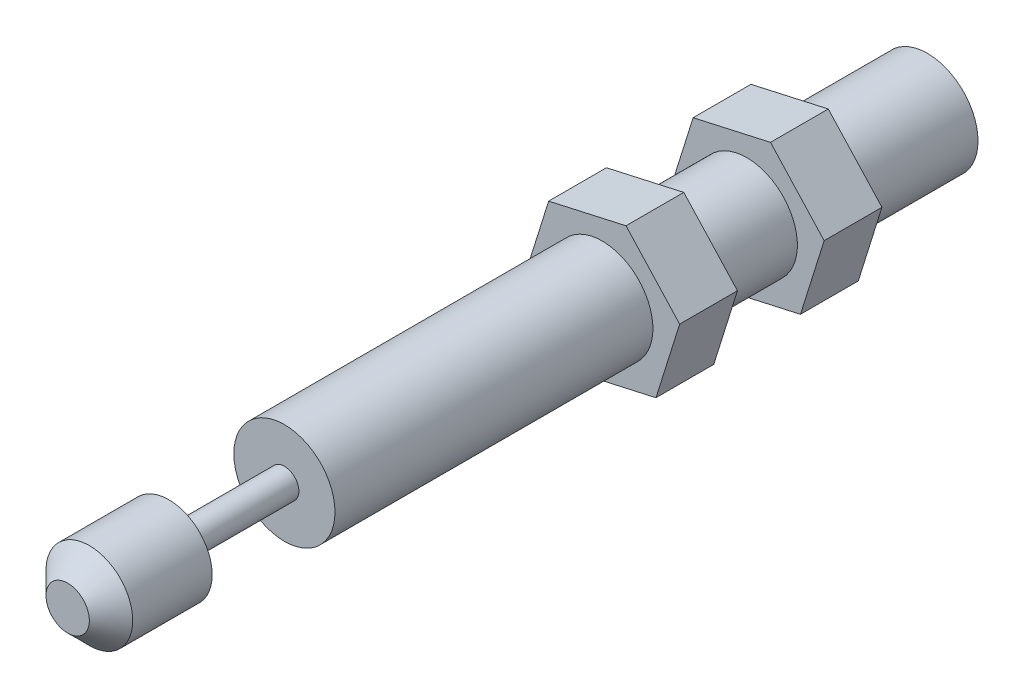
from build123d import *

# Parameters (mm, degrees)
SKETCH_1_R             = 7
EXTRUDE_1_DEPTH        = 89
SKETCH_2_R             = 2
EXTRUDE_2_DEPTH        = 16
SKETCH_3_R             = 6
EXTRUDE_3_DEPTH        = 14
CHAMFER_1_SIZE         = 3
EXTRUDE_4_DEPTH        = 8
PATTERN_LINEAR_1_COUNT = 2
PATTERN_LINEAR_1_PITCH = 20


with BuildPart() as part:
    # 草图1 → 凸台-拉伸1 (new body)
    with BuildSketch(Plane.XY):
        Circle(SKETCH_1_R)
    extrude(amount=EXTRUDE_1_DEPTH)

    # 草图2 → 凸台-拉伸2 (add)
    with BuildSketch(Plane.XY.offset(89)):
        Circle(SKETCH_2_R)
    extrude(amount=EXTRUDE_2_DEPTH)

    # 草图3 → 凸台-拉伸3 (add)
    with BuildSketch(Plane.XY.offset(105)):
        Circle(SKETCH_3_R)
    extrude(amount=EXTRUDE_3_DEPTH)

    # 倒角1
    chamfer_1_edges = [part.edges().sort_by_distance(p)[0] for p in [
        (-6, 0, 119),
    ]]
    chamfer(chamfer_1_edges, length=CHAMFER_1_SIZE)

    # 草图4 → 凸台-拉伸4 (add)
    with BuildSketch(Plane(origin=(0, 0, 25), x_dir=(-1, 0, 0), z_dir=(0, 0, -1))):
        Polygon((-3.277805691, 10.468491925), (-10.704882792, 2.395582966), (-7.427077101, -8.07290896), (3.277805691, -10.468491925), (10.704882792, -2.395582966), (7.427077101, 8.07290896), align=None)
    extrude_4 = extrude(amount=EXTRUDE_4_DEPTH)

    # 阵列(线性)1: 凸台-拉伸4 ×2
    with Locations(*[(0, 0, i * PATTERN_LINEAR_1_PITCH) for i in range(1, PATTERN_LINEAR_1_COUNT)]):
        add(extrude_4)


solid = part.part
